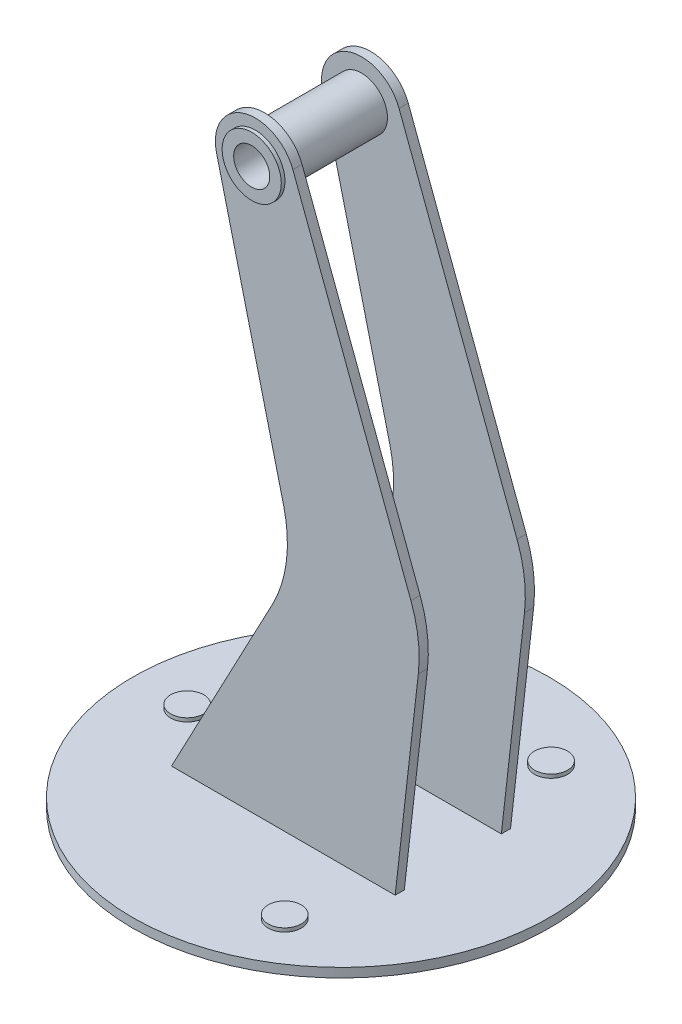
from build123d import *

# Parameters (mm, degrees)
SKETCH1_R           = 9.810131349
BOSS_EXTRUDE1_DEPTH = 5
BOSS_EXTRUDE2_DEPTH = 5
SKETCH3_R           = 9.810131349
CUT_EXTRUDE1_DEPTH  = 84
SKETCH4_R           = 14.076801766
SKETCH4_R_2         = 9.810131349
BOSS_EXTRUDE3_DEPTH = 52.766798881
SKETCH5_R           = 16.090138016
SKETCH5_R_2         = 9.810131349
BOSS_EXTRUDE4_DEPTH = 2
BOSS_EXTRUDE5_START = 2
SKETCH6_R           = 16.090138016
SKETCH6_R_2         = 9.810131349
BOSS_EXTRUDE5_DEPTH = 2
FILLET1_R           = 70
FILLET2_R           = 70
SKETCH7_R           = 113.336684476
BOSS_EXTRUDE6_DEPTH = 5
SKETCH8_R           = 9
BOSS_EXTRUDE7_DEPTH = 2
CIRPATTERN1_COUNT   = 3


with BuildPart() as part:
    # Sketch1 → Boss-Extrude1 (new body)
    with BuildSketch(Plane.XY):
        with BuildLine():
            Line((13.558833442, -204.742742467), (81, -77.453492295))
            Line((81, -77.453492295), (38.254158828, 95.740673586))
            ThreePointArc((38.254158828, 95.740673586), (52.434483395, 122.335809156), (79.608676046, 109.299471687))
            Line((79.608676046, 109.299471687), (149.768395279, -77.453492295))
            Line((149.768395279, -77.453492295), (135.270890905, -204.742742467))
            Line((135.270890905, -204.742742467), (13.558833442, -204.742742467))
        make_face()
        with Locations((59.220022764, 101.639822494)):
            Circle(SKETCH1_R, mode=Mode.SUBTRACT)
    extrude(amount=BOSS_EXTRUDE1_DEPTH)



with BuildPart() as body_2:
    # Sketch2 → Boss-Extrude2 (new body)
    with BuildSketch(Plane(origin=(0, 0, 62.766798881), x_dir=(-1, 0, 0), z_dir=(0, 0, -1))):
        with BuildLine():
            Line((-135.270890905, -204.742742467), (-13.558833442, -204.742742467))
            Line((-13.558833442, -204.742742467), (-81, -77.453492295))
            Line((-81, -77.453492295), (-38.254158828, 95.740673586))
            ThreePointArc((-38.254158828, 95.740673586), (-52.434483395, 122.335809156), (-79.608676046, 109.299471687))
            Line((-79.608676046, 109.299471687), (-149.768395279, -77.453492295))
            Line((-149.768395279, -77.453492295), (-135.270890905, -204.742742467))
        make_face()
    extrude(amount=BOSS_EXTRUDE2_DEPTH)

    # Sketch3 → Cut-Extrude1 (cut)
    with BuildSketch(Plane.XY.offset(5)):
        with Locations((59.220022764, 101.639822494)):
            Circle(SKETCH3_R)
    extrude(amount=CUT_EXTRUDE1_DEPTH, mode=Mode.SUBTRACT)


with BuildPart() as part_1:
    add(part.part)

    add(body_2.part)  # Boss-Extrude3 merges body 2
    # Sketch4 → Boss-Extrude3 (add)
    with BuildSketch(Plane.XY.offset(5)):
        with Locations(Location((59.220022764, 101.639822494, 0), (0, 0, 90))):
            Circle(SKETCH4_R)
        with Locations(Location((59.220022764, 101.639822494, 0), (0, 0, 90))):
            Circle(SKETCH4_R_2, mode=Mode.SUBTRACT)
    extrude(amount=BOSS_EXTRUDE3_DEPTH)

    # Sketch5 → Boss-Extrude4 (add)
    with BuildSketch(Plane.XY.offset(62.766798881)):
        with Locations(Location((59.220022764, 101.639822494, 0), (0, 0, 90))):
            Circle(SKETCH5_R)
        with Locations((59.220022764, 101.639822494)):
            Circle(SKETCH5_R_2, mode=Mode.SUBTRACT)
    extrude(amount=BOSS_EXTRUDE4_DEPTH)

    # Sketch6 → Boss-Extrude5 (add)
    with BuildSketch(Plane(origin=(0, 0, 0), x_dir=(-1, 0, 0), z_dir=(0, 0, -1)).offset(BOSS_EXTRUDE5_START)):
        with Locations(Location((-59.220022764, 101.639822494, 0), (0, 0, 90))):
            Circle(SKETCH6_R)
        with Locations((-59.220022764, 101.639822494)):
            Circle(SKETCH6_R_2, mode=Mode.SUBTRACT)
    extrude(amount=-BOSS_EXTRUDE5_DEPTH)

    # Fillet1
    fillet1_edges = [part_1.edges().sort_by_distance(p)[0] for p in [
        (81, -77.453492295, 2.5),
        (81, -77.453492295, 60.266798881),
    ]]
    fillet(fillet1_edges, radius=FILLET1_R)

    # Fillet2
    fillet2_edges = [part_1.edges().sort_by_distance(p)[0] for p in [
        (149.768395279, -77.453492295, 2.5),
        (149.768395279, -77.453492295, 60.266798881),
    ]]
    fillet(fillet2_edges, radius=FILLET2_R)

    # Sketch7 → Boss-Extrude6 (add)
    with BuildSketch(Plane(origin=(0, -204.742742467, 0), x_dir=(-1, 0, 0), z_dir=(0, -1, 0))):
        with Locations(Location((-74.414862174, -31.38339944, 0), (0, 0, 90))):
            Circle(SKETCH7_R)
    extrude(amount=BOSS_EXTRUDE6_DEPTH)

    # Sketch8 → Boss-Extrude7 (add)
    with BuildSketch(Plane(origin=(0, -204.742742467, 0), x_dir=(1, 0, 0), z_dir=(0, 1, 0))):
        with Locations(Location((-9.24845496, -31.38339944, 0), (0, 0, 90))):
            Circle(SKETCH8_R)
    boss_extrude7 = extrude(amount=BOSS_EXTRUDE7_DEPTH)

    # CirPattern1: Boss-Extrude7 ×3 about axis
    cirpattern1_axis = Axis((74.414862174, 0, 31.38339944), (0, 1, 0))
    for i in range(1, CIRPATTERN1_COUNT):
        add(boss_extrude7.rotate(cirpattern1_axis, i * 360 / CIRPATTERN1_COUNT))


solid = part_1.part
